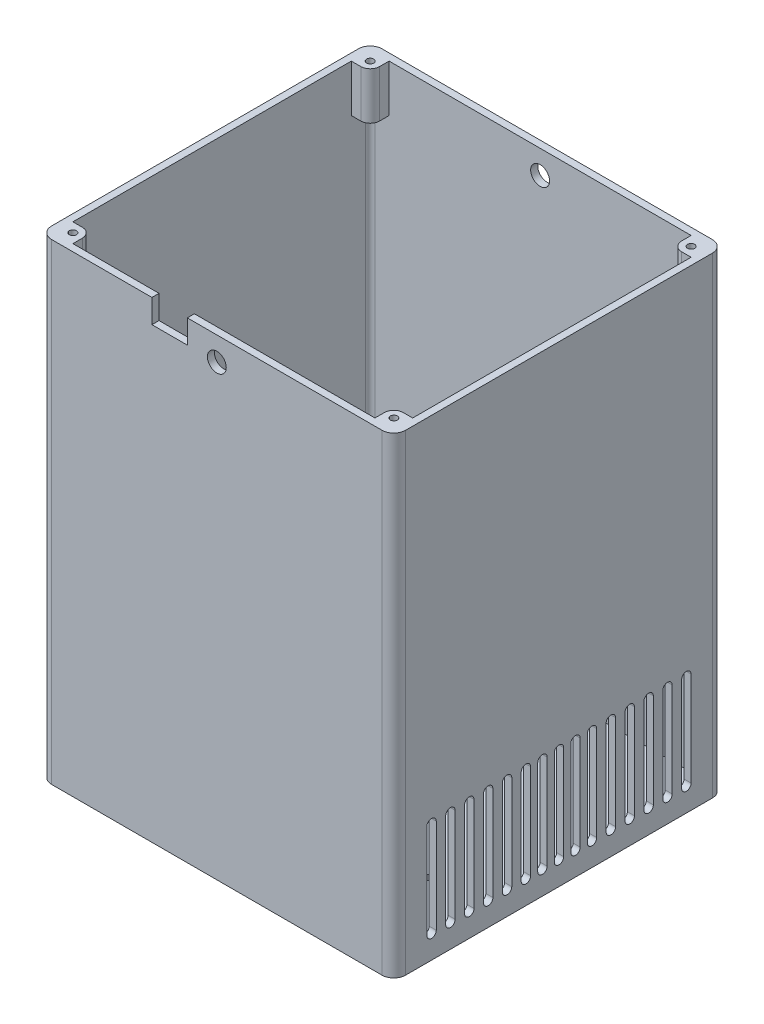
from build123d import *

# Parameters (mm, degrees)
BOSS_EXTRUDE1_DEPTH = 200
SHELL1_T            = -3
SKETCH2_R           = 4
CUT_EXTRUDE1_DEPTH  = 256.391855782
CUT_EXTRUDE2_DEPTH  = 260.615099715
SKETCH4_W           = 15
SKETCH4_H           = 15
CUT_EXTRUDE3_DEPTH  = 223.112584065
SKETCH5_W           = 15
SKETCH5_H           = 20
CUT_EXTRUDE4_DEPTH  = 10
SKETCH6_R           = 1.5
SKETCH6_R_2         = 1.564454448
CUT_EXTRUDE5_DEPTH  = 223.112584065
BOSS_EXTRUDE2_START = -20
SKETCH7_R           = 1.5
BOSS_EXTRUDE2_DEPTH = 20
SKETCH8_R           = 1.5
CUT_EXTRUDE6_DEPTH  = 223.112584065


with BuildPart() as part:
    # Sketch1 → Boss-Extrude1 (new body)
    with BuildSketch(Plane(origin=(0, 0, 0), x_dir=(1, 0, 0), z_dir=(0, 1, 0))):
        with BuildLine():
            Line((70, -70), (-70, -70))
            ThreePointArc((-70, -70), (-73.535533906, -68.535533906), (-75, -65))
            Line((-75, -65), (-75, 65))
            ThreePointArc((-75, 65), (-73.535533906, 68.535533906), (-70, 70))
            Line((-70, 70), (70, 70))
            ThreePointArc((70, 70), (73.535533906, 68.535533906), (75, 65))
            Line((75, 65), (75, -65))
            ThreePointArc((75, -65), (73.535533906, -68.535533906), (70, -70))
        make_face()
    extrude(amount=BOSS_EXTRUDE1_DEPTH)

    # Shell1
    shell1_openings = [part.faces().sort_by_distance(p)[0] for p in [
        (0, 200, 0),
    ]]
    offset(amount=SHELL1_T, openings=shell1_openings, kind=Kind.INTERSECTION)

    # Sketch2 → Cut-Extrude1 (cut, through all)
    with BuildSketch(Plane.XY.offset(70)):
        with Locations((0, 190)):
            Circle(SKETCH2_R)
    extrude(amount=-CUT_EXTRUDE1_DEPTH, mode=Mode.SUBTRACT)

    # Sketch3 → Cut-Extrude2 (cut, through all)
    with BuildSketch(Plane(origin=(75, 0, 0), x_dir=(0, 0, -1), z_dir=(1, 0, 0))):
        with BuildLine():
            Line((2, 50), (2, 10))
            ThreePointArc((2, 10), (0, 8), (-2, 10))
            Line((-2, 10), (-2, 50))
            ThreePointArc((-2, 50), (0, 52), (2, 50))
        make_face()
        with BuildLine():
            Line((5, 50), (5, 10))
            ThreePointArc((5, 10), (7, 8), (9, 10))
            Line((9, 10), (9, 50))
            ThreePointArc((9, 50), (7, 52), (5, 50))
        make_face()
        with BuildLine():
            Line((12, 50), (12, 10))
            ThreePointArc((12, 10), (14, 8), (16, 10))
            Line((16, 10), (16, 50))
            ThreePointArc((16, 50), (14, 52), (12, 50))
        make_face()
        with BuildLine():
            Line((-9, 50), (-9, 10))
            ThreePointArc((-9, 10), (-7, 8), (-5, 10))
            Line((-5, 10), (-5, 50))
            ThreePointArc((-5, 50), (-7, 52), (-9, 50))
        make_face()
        with BuildLine():
            Line((-16, 50), (-16, 10))
            ThreePointArc((-16, 10), (-14, 8), (-12, 10))
            Line((-12, 10), (-12, 50))
            ThreePointArc((-12, 50), (-14, 52), (-16, 50))
        make_face()
        with BuildLine():
            Line((24, 50), (24, 10))
            ThreePointArc((24, 10), (22, 8), (20, 10))
            Line((20, 10), (20, 50))
            ThreePointArc((20, 50), (22, 52), (24, 50))
        make_face()
        with BuildLine():
            Line((32, 50), (32, 10))
            ThreePointArc((32, 10), (30, 8), (28, 10))
            Line((28, 10), (28, 50))
            ThreePointArc((28, 50), (30, 52), (32, 50))
        make_face()
        with BuildLine():
            Line((40, 50), (40, 10))
            ThreePointArc((40, 10), (38, 8), (36, 10))
            Line((36, 10), (36, 50))
            ThreePointArc((36, 50), (38, 52), (40, 50))
        make_face()
        with BuildLine():
            Line((48, 50), (48, 10))
            ThreePointArc((48, 10), (46, 8), (44, 10))
            Line((44, 10), (44, 50))
            ThreePointArc((44, 50), (46, 52), (48, 50))
        make_face()
        with BuildLine():
            Line((56, 50), (56, 10))
            ThreePointArc((56, 10), (54, 8), (52, 10))
            Line((52, 10), (52, 50))
            ThreePointArc((52, 50), (54, 52), (56, 50))
        make_face()
        with BuildLine():
            Line((-20, 50), (-20, 10))
            ThreePointArc((-20, 10), (-22, 8), (-24, 10))
            Line((-24, 10), (-24, 50))
            ThreePointArc((-24, 50), (-22, 52), (-20, 50))
        make_face()
        with BuildLine():
            Line((-28, 50), (-28, 10))
            ThreePointArc((-28, 10), (-30, 8), (-32, 10))
            Line((-32, 10), (-32, 50))
            ThreePointArc((-32, 50), (-30, 52), (-28, 50))
        make_face()
        with BuildLine():
            Line((-36, 50), (-36, 10))
            ThreePointArc((-36, 10), (-38, 8), (-40, 10))
            Line((-40, 10), (-40, 50))
            ThreePointArc((-40, 50), (-38, 52), (-36, 50))
        make_face()
        with BuildLine():
            Line((-44, 50), (-44, 10))
            ThreePointArc((-44, 10), (-46, 8), (-48, 10))
            Line((-48, 10), (-48, 50))
            ThreePointArc((-48, 50), (-46, 52), (-44, 50))
        make_face()
        with BuildLine():
            Line((-52, 50), (-52, 10))
            ThreePointArc((-52, 10), (-54, 8), (-56, 10))
            Line((-56, 10), (-56, 50))
            ThreePointArc((-56, 50), (-54, 52), (-52, 50))
        make_face()
    extrude(amount=-CUT_EXTRUDE2_DEPTH, mode=Mode.SUBTRACT)

    # Sketch4 → Cut-Extrude3 (cut, through all)
    with BuildSketch(Plane(origin=(0, 3, 0), x_dir=(1, 0, 0), z_dir=(0, 1, 0))):
        with Locations((-41.272139349, -30.5)):
            Rectangle(SKETCH4_W, SKETCH4_H)
    extrude(amount=-CUT_EXTRUDE3_DEPTH, mode=Mode.SUBTRACT)

    # Sketch5 → Cut-Extrude4 (cut)
    with BuildSketch(Plane.XY.offset(70)):
        with Locations((-20, 200)):
            Rectangle(SKETCH5_W, SKETCH5_H)
    extrude(amount=-CUT_EXTRUDE4_DEPTH, mode=Mode.SUBTRACT)

    # Sketch6 → Cut-Extrude5 (cut, through all)
    with BuildSketch(Plane(origin=(0, 3, 0), x_dir=(1, 0, 0), z_dir=(0, 1, 0))):
        with Locations(Location((11.025518851, -27.599409996, 0), (0, 0, 270))):
            Circle(SKETCH6_R)
        with Locations(Location((11.025518851, 23.900590004, 0), (0, 0, 270))):
            Circle(SKETCH6_R)
        with Locations(Location((46.625518851, 23.900590004, 0), (0, 0, 270))):
            Circle(SKETCH6_R)
        with Locations(Location((46.625518851, -27.599409996, 0), (0, 0, 270))):
            Circle(SKETCH6_R_2)
    extrude(amount=-CUT_EXTRUDE5_DEPTH, mode=Mode.SUBTRACT)

    # Sketch7 → Boss-Extrude2 (add)
    # profile 1 of 4: a face of its own
    with BuildSketch(Plane(origin=(0, 200, 0), x_dir=(1, 0, 0), z_dir=(0, 1, 0)).offset(BOSS_EXTRUDE2_START)):
        with BuildLine():
            Line((-64, 63), (-64, 67))
            Line((-64, 67), (-70, 67))
            ThreePointArc((-70, 67), (-71.414213562, 66.414213562), (-72, 65))
            Line((-72, 65), (-72, 59))
            Line((-72, 59), (-68, 59))
            ThreePointArc((-68, 59), (-65.171572875, 60.171572875), (-64, 63))
        make_face()
        with Locations(Location((-68, 63, 0), (0, 0, 270))):
            Circle(SKETCH7_R, mode=Mode.SUBTRACT)
    # profile 2 of 4: a face of its own
    with BuildSketch(Plane(origin=(0, 200, 0), x_dir=(1, 0, 0), z_dir=(0, 1, 0)).offset(BOSS_EXTRUDE2_START)):
        with BuildLine():
            Line((72, 65), (72, 59))
            Line((72, 59), (68, 59))
            ThreePointArc((68, 59), (65.171572875, 60.171572875), (64, 63))
            Line((64, 63), (64, 67))
            Line((64, 67), (70, 67))
            ThreePointArc((70, 67), (71.414213562, 66.414213562), (72, 65))
        make_face()
        with Locations(Location((68, 63, 0), (0, 0, 270))):
            Circle(SKETCH7_R, mode=Mode.SUBTRACT)
    # profile 3 of 4: a face of its own
    with BuildSketch(Plane(origin=(0, 200, 0), x_dir=(1, 0, 0), z_dir=(0, 1, 0)).offset(BOSS_EXTRUDE2_START)):
        with BuildLine():
            Line((64, -67), (70, -67))
            ThreePointArc((70, -67), (71.414213562, -66.414213562), (72, -65))
            Line((72, -65), (72, -59))
            Line((72, -59), (68, -59))
            ThreePointArc((68, -59), (65.171572875, -60.171572875), (64, -63))
            Line((64, -63), (64, -67))
        make_face()
        with Locations(Location((68, -63, 0), (0, 0, 270))):
            Circle(SKETCH7_R, mode=Mode.SUBTRACT)
    # profile 4 of 4: a face of its own
    with BuildSketch(Plane(origin=(0, 200, 0), x_dir=(1, 0, 0), z_dir=(0, 1, 0)).offset(BOSS_EXTRUDE2_START)):
        with BuildLine():
            Line((-72, -65), (-72, -59))
            Line((-72, -59), (-68, -59))
            ThreePointArc((-68, -59), (-65.171572875, -60.171572875), (-64, -63))
            Line((-64, -63), (-64, -67))
            Line((-64, -67), (-70, -67))
            ThreePointArc((-70, -67), (-71.414213562, -66.414213562), (-72, -65))
        make_face()
        with Locations(Location((-68, -63, 0), (0, 0, 270))):
            Circle(SKETCH7_R, mode=Mode.SUBTRACT)
    extrude(amount=BOSS_EXTRUDE2_DEPTH)

    # Sketch8 → Cut-Extrude6 (cut, through all)
    with BuildSketch(Plane(origin=(0, 3, 0), x_dir=(1, 0, 0), z_dir=(0, 1, 0))):
        with Locations(Location((-60, 55, 0), (0, 0, 270))):
            Circle(SKETCH8_R)
        with Locations(Location((-60, -55, 0), (0, 0, 90))):
            Circle(SKETCH8_R)
        with Locations(Location((60, -55, 0), (0, 0, 270))):
            Circle(SKETCH8_R)
        with Locations(Location((60, 55, 0), (0, 0, 90))):
            Circle(SKETCH8_R)
    extrude(amount=-CUT_EXTRUDE6_DEPTH, mode=Mode.SUBTRACT)


solid = part.part
